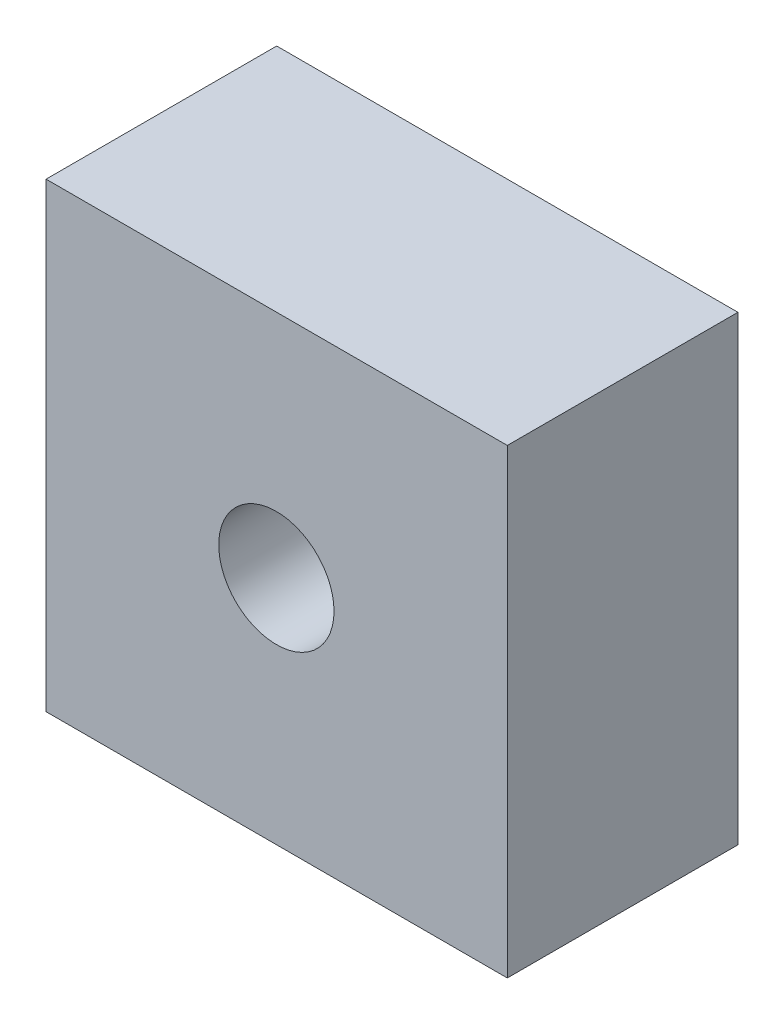
from build123d import *

# Parameters (mm, degrees)
SKETCH_1_W      = 20
SKETCH_1_H      = 20
BASEBOX_DEPTH   = 10
HOLE_WIZARD_1_D = 5


with BuildPart() as part:
    # 草图1 → BaseBox (new body)
    with BuildSketch(Plane.XY):
        with Locations((10, 10)):
            Rectangle(SKETCH_1_W, SKETCH_1_H)
    extrude(amount=BASEBOX_DEPTH)

    # 孔1 (through all)
    with Locations(Plane.XY.offset(10)):
        with Locations((9.986487375, 10.014305599)):
            Hole(HOLE_WIZARD_1_D / 2)


solid = part.part
